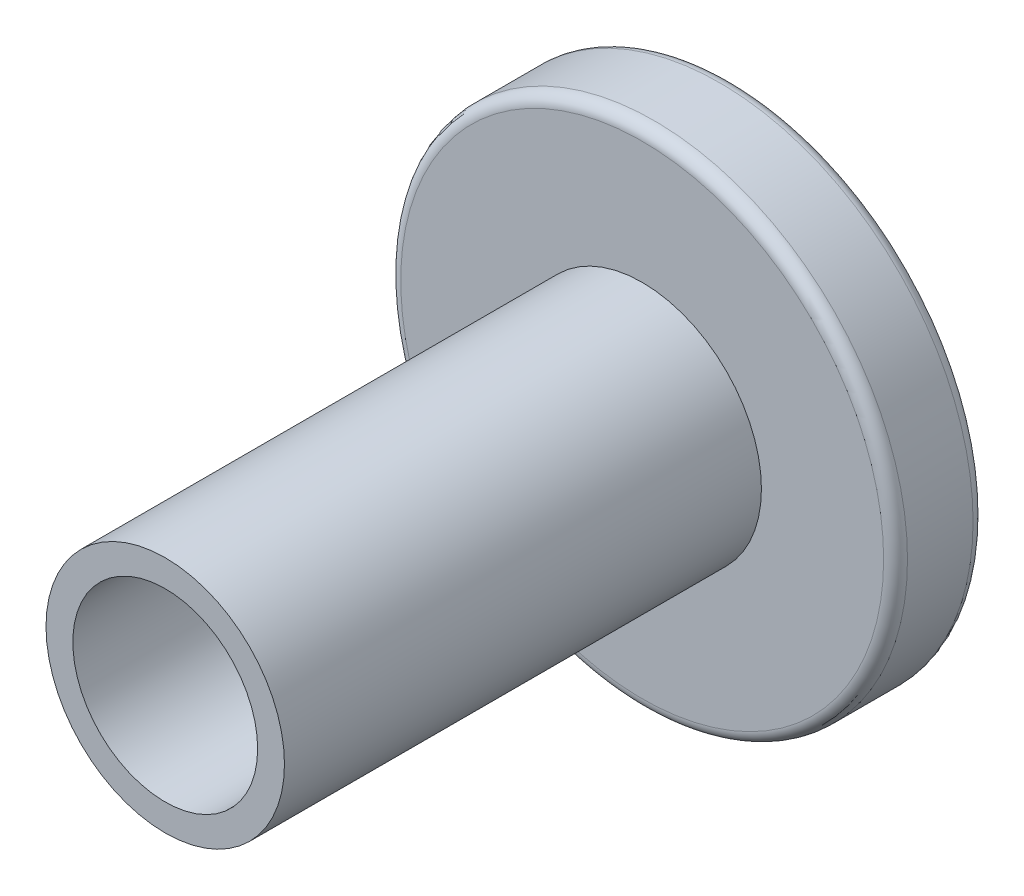
from build123d import *

# Parameters (mm, degrees)
SKETCH_1_R          = 4.25
EXTRUDE_1_DEPTH     = 1.5
SKETCH_2_R          = 2
SKETCH_2_R_2        = 1.55
EXTRUDE_2_DEPTH     = 8
FILLET_1_R          = 0.2
CUT_EXTRUDE_1_DEPTH = 1.5


with BuildPart() as part:
    # 草图1 → 凸台-拉伸1 (new body)
    with BuildSketch(Plane.XY):
        Circle(SKETCH_1_R)
    extrude(amount=EXTRUDE_1_DEPTH)

    # 草图2 → 凸台-拉伸2 (add)
    with BuildSketch(Plane.XY.offset(1.5)):
        Circle(SKETCH_2_R)
        Circle(SKETCH_2_R_2, mode=Mode.SUBTRACT)
    extrude(amount=EXTRUDE_2_DEPTH)

    # 圆角1
    fillet_1_edges = [part.edges().sort_by_distance(p)[0] for p in [
        (-4.25, 0, 0),
        (-4.25, 0, 1.5),
    ]]
    fillet(fillet_1_edges, radius=FILLET_1_R)

    # 草图3 → 切除-拉伸1 (cut)
    with BuildSketch(Plane(origin=(0, 0, 0), x_dir=(-1, 0, 0), z_dir=(0, 0, -1))):
        Polygon((1.443375673, 0), (0.721687836, 1.25), (-0.721687836, 1.25), (-1.443375673, 0), (-0.721687836, -1.25), (0.721687836, -1.25), align=None)
    extrude(amount=-CUT_EXTRUDE_1_DEPTH, mode=Mode.SUBTRACT)


solid = part.part
